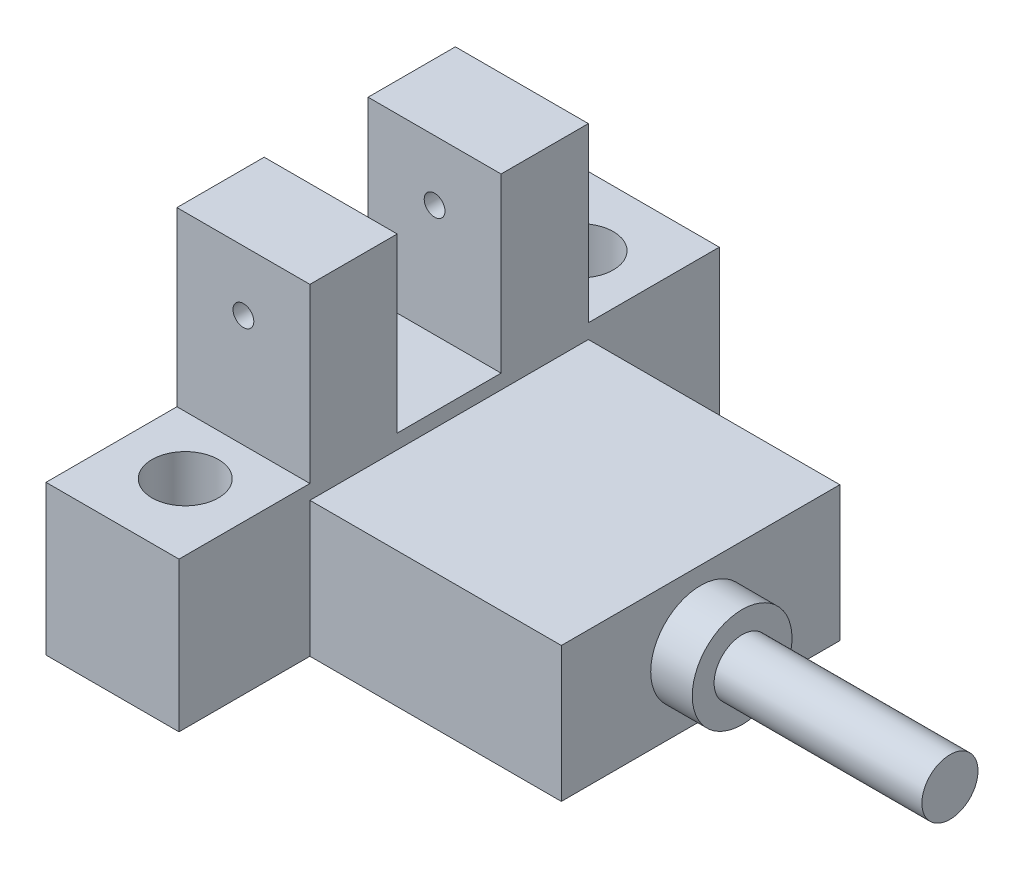
from build123d import *

# Parameters (mm, degrees)
AUFSATZ_LINEAR_AUSTRAGEN1_DEPTH = 26
SKIZZE2_W                       = 12.1
SKIZZE2_H                       = 6.3
SCHNITT_LINEAR_AUSTRAGEN1_DEPTH = 26
SKIZZE3_W                       = 6.4
SKIZZE3_H                       = 6.3
SCHNITT_LINEAR_AUSTRAGEN2_DEPTH = 8.3
SKIZZE4_W                       = 6.4
SKIZZE4_H                       = 5
SCHNITT_LINEAR_AUSTRAGEN3_DEPTH = 8.3
SKIZZE5_R                       = 0.5
SCHNITT_LINEAR_AUSTRAGEN4_DEPTH = 32.154293444
SKIZZE6_R                       = 1.6
SCHNITT_LINEAR_AUSTRAGEN5_DEPTH = 8.3
SKIZZE7_R                       = 2.4
AUFSATZ_LINEAR_AUSTRAGEN2_DEPTH = 2
SKIZZE8_R                       = 1.35
AUFSATZ_LINEAR_AUSTRAGEN3_DEPTH = 10


with BuildPart() as part:
    # Skizze1 → Aufsatz-Linear austragen1 (new body)
    with BuildSketch(Plane.XY):
        Polygon((0, 0), (0, 15.5), (6.4, 15.5), (6.4, 6.5), (18.5, 6.5), (18.5, 0), align=None)
    extrude(amount=AUFSATZ_LINEAR_AUSTRAGEN1_DEPTH)

    # Skizze2 → Schnitt-Linear austragen1 (cut)
    with BuildSketch(Plane(origin=(0, 6.5, 0), x_dir=(1, 0, 0), z_dir=(0, 1, 0))):
        with Locations((12.45, -22.85)):
            Rectangle(SKIZZE2_W, SKIZZE2_H)
        with Locations((12.45, -3.15)):
            Rectangle(SKIZZE2_W, SKIZZE2_H)
    extrude(amount=-SCHNITT_LINEAR_AUSTRAGEN1_DEPTH, mode=Mode.SUBTRACT)

    # Skizze3 → Schnitt-Linear austragen2 (cut)
    with BuildSketch(Plane(origin=(0, 15.5, 0), x_dir=(1, 0, 0), z_dir=(0, 1, 0))):
        with Locations((3.2, -22.85)):
            Rectangle(SKIZZE3_W, SKIZZE3_H)
        with Locations((3.2, -3.15)):
            Rectangle(SKIZZE3_W, SKIZZE3_H)
    extrude(amount=-SCHNITT_LINEAR_AUSTRAGEN2_DEPTH, mode=Mode.SUBTRACT)

    # Skizze4 → Schnitt-Linear austragen3 (cut)
    with BuildSketch(Plane(origin=(0, 15.5, 0), x_dir=(1, 0, 0), z_dir=(0, 1, 0))):
        with Locations((3.2, -13)):
            Rectangle(SKIZZE4_W, SKIZZE4_H)
    extrude(amount=-SCHNITT_LINEAR_AUSTRAGEN3_DEPTH, mode=Mode.SUBTRACT)

    # Skizze5 → Schnitt-Linear austragen4 (cut, through all)
    with BuildSketch(Plane.XY.offset(19.7)):
        with Locations((3.2, 12.6)):
            Circle(SKIZZE5_R)
    extrude(amount=-SCHNITT_LINEAR_AUSTRAGEN4_DEPTH, mode=Mode.SUBTRACT)

    # Skizze6 → Schnitt-Linear austragen5 (cut)
    with BuildSketch(Plane(origin=(0, 7.2, 0), x_dir=(1, 0, 0), z_dir=(0, 1, 0))):
        with Locations(Location((3.2, -22.5, 0), (0, 0, 270))):
            Circle(SKIZZE6_R)
        with Locations(Location((3.2, -3.5, 0), (0, 0, 270))):
            Circle(SKIZZE6_R)
    extrude(amount=-SCHNITT_LINEAR_AUSTRAGEN5_DEPTH, mode=Mode.SUBTRACT)

    # Skizze7 → Aufsatz-Linear austragen2 (add)
    with BuildSketch(Plane(origin=(18.5, 0, 0), x_dir=(0, 0, -1), z_dir=(1, 0, 0))):
        with Locations(Location((-13, 3.25, 0), (0, 0, 180))):
            Circle(SKIZZE7_R)
    extrude(amount=AUFSATZ_LINEAR_AUSTRAGEN2_DEPTH)

    # Skizze8 → Aufsatz-Linear austragen3 (add)
    with BuildSketch(Plane(origin=(20.5, 0, 0), x_dir=(0, 0, -1), z_dir=(1, 0, 0))):
        with Locations((-13, 3.25)):
            Circle(SKIZZE8_R)
    extrude(amount=AUFSATZ_LINEAR_AUSTRAGEN3_DEPTH)


solid = part.part
